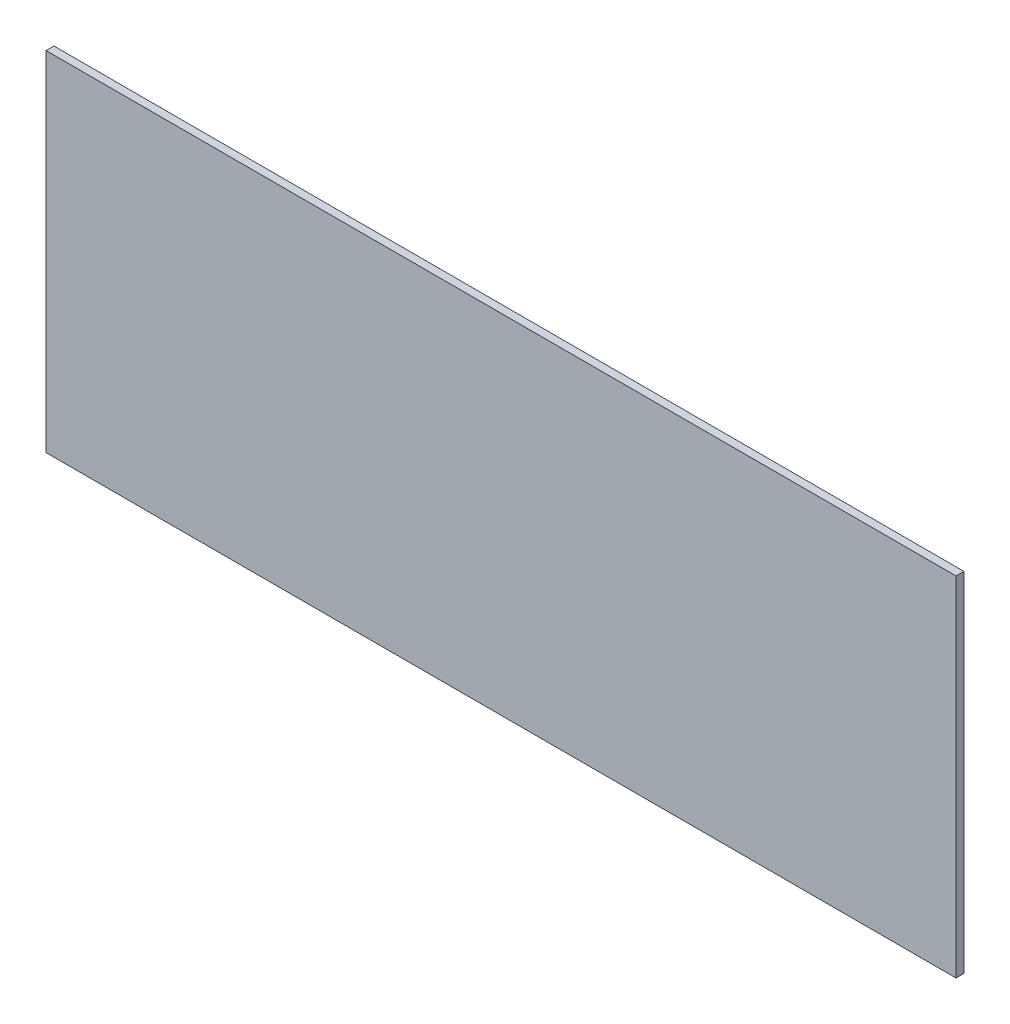
from build123d import *

# Parameters (mm, degrees)
SKETCH1_W           = 1150
SKETCH1_H           = 440
BOSS_EXTRUDE1_DEPTH = 10


with BuildPart() as part:
    # Sketch1 → Boss-Extrude1 (new body)
    with BuildSketch(Plane.XY):
        Rectangle(SKETCH1_W, SKETCH1_H)
    extrude(amount=BOSS_EXTRUDE1_DEPTH)


solid = part.part
